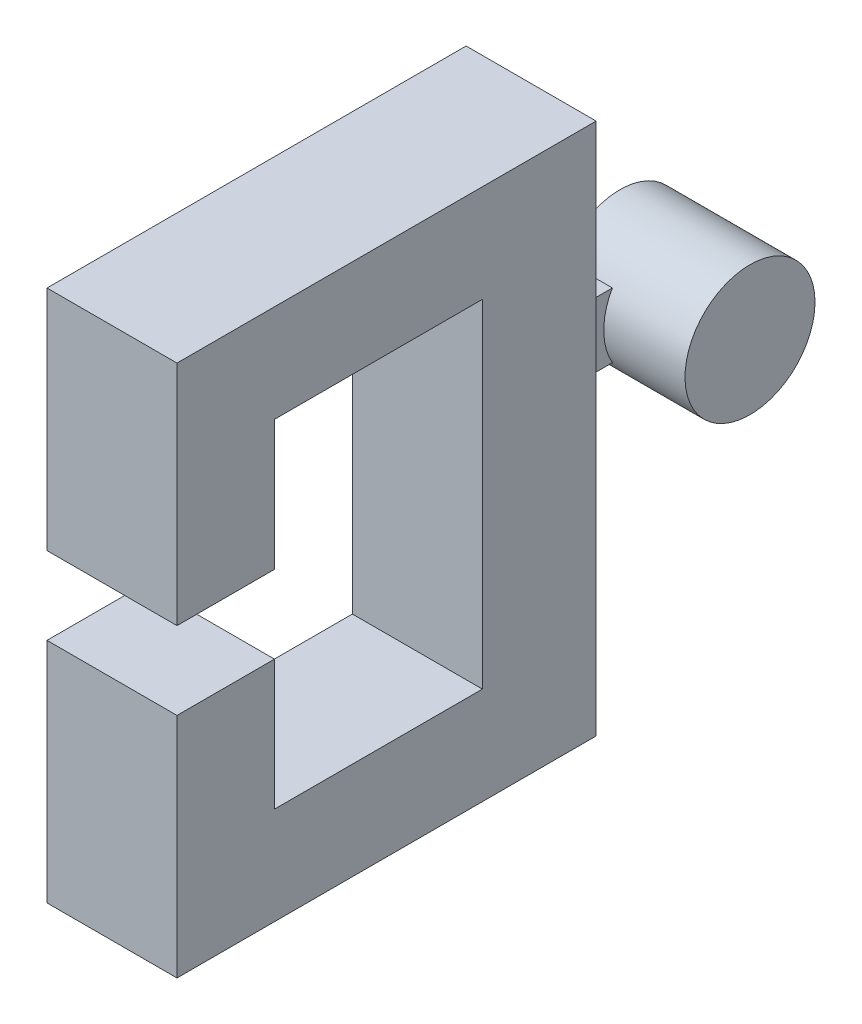
from build123d import *

# Parameters (mm, degrees)
BOSS_EXTRUDE1_DEPTH = 25.4
CUT_EXTRUDE1_START  = -15.875
CUT_EXTRUDE1_DEPTH  = 15.875


with BuildPart() as part:
    # Sketch1 → Boss-Extrude1 (new body)
    with BuildSketch(Plane.YZ):
        with BuildLine():
            Line((0, 0), (44.42968, 0))
            Line((44.42968, 0), (44.42968, -19.05))
            Line((44.42968, -19.05), (19.05, -19.05))
            Line((19.05, -19.05), (19.05, -59.6646))
            Line((19.05, -59.6646), (84.99856, -59.6646))
            Line((84.99856, -59.6646), (84.99856, -19.05))
            Line((84.99856, -19.05), (59.61888, -19.05))
            Line((59.61888, -19.05), (59.61888, 0))
            Line((59.61888, 0), (104.04856, 0))
            Line((104.04856, 0), (104.04856, -81.8896))
            Line((104.04856, -81.8896), (58.34888, -81.8896))
            Line((58.34888, -81.8896), (58.34888, -100.9396))
            ThreePointArc((58.34888, -100.9396), (52.02428, -124.652748271), (45.69968, -100.9396))
            Line((45.69968, -100.9396), (45.69968, -81.8896))
            Line((45.69968, -81.8896), (0, -81.8896))
            Line((0, -81.8896), (0, 0))
        make_face()
    extrude(amount=BOSS_EXTRUDE1_DEPTH)

    # Sketch2 → Cut-Extrude1 (cut)
    with BuildSketch(Plane.YZ.offset(25.4).offset(CUT_EXTRUDE1_START)):
        with BuildLine():
            Line((45.69968, -81.8896), (58.34888, -81.8896))
            Line((58.34888, -81.8896), (58.34888, -100.9396))
            ThreePointArc((58.34888, -100.9396), (52.02428, -99.252748271), (45.69968, -100.9396))
            Line((45.69968, -100.9396), (45.69968, -81.8896))
        make_face()
    extrude(amount=CUT_EXTRUDE1_DEPTH, mode=Mode.SUBTRACT)


solid = part.part
